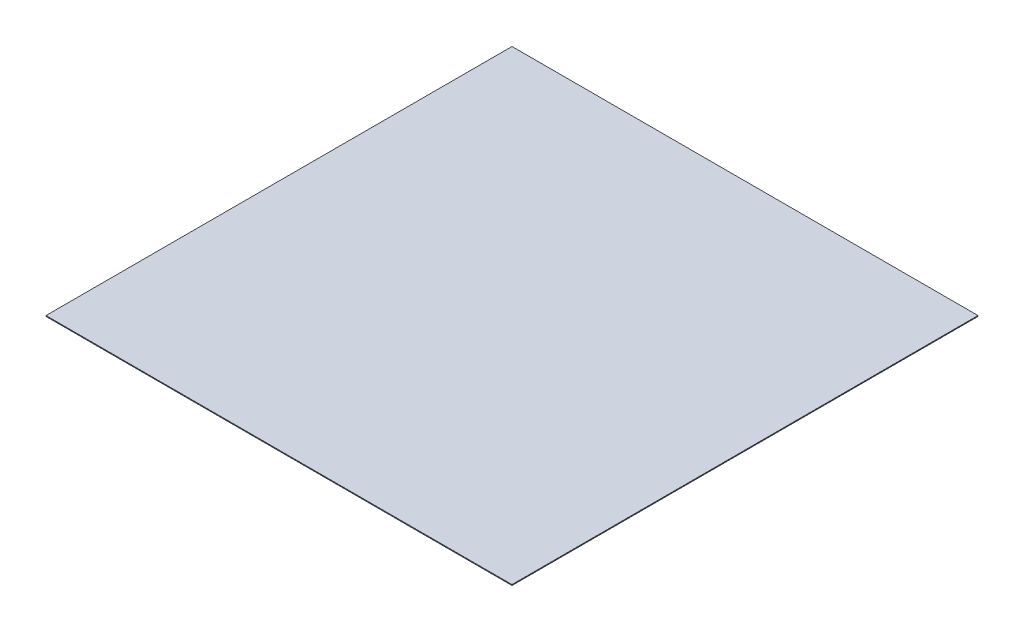
from build123d import *

# Parameters (mm, degrees)
SKETCH1_W           = 565.68542495
SKETCH1_H           = 565.68542495
BOSS_EXTRUDE1_DEPTH = 1


with BuildPart() as part:
    # Sketch1 → Boss-Extrude1 (new body)
    with BuildSketch(Plane(origin=(0, 0, 0), x_dir=(1, 0, 0), z_dir=(0, 1, 0))):
        Rectangle(SKETCH1_W, SKETCH1_H)
    extrude(amount=BOSS_EXTRUDE1_DEPTH)


solid = part.part
